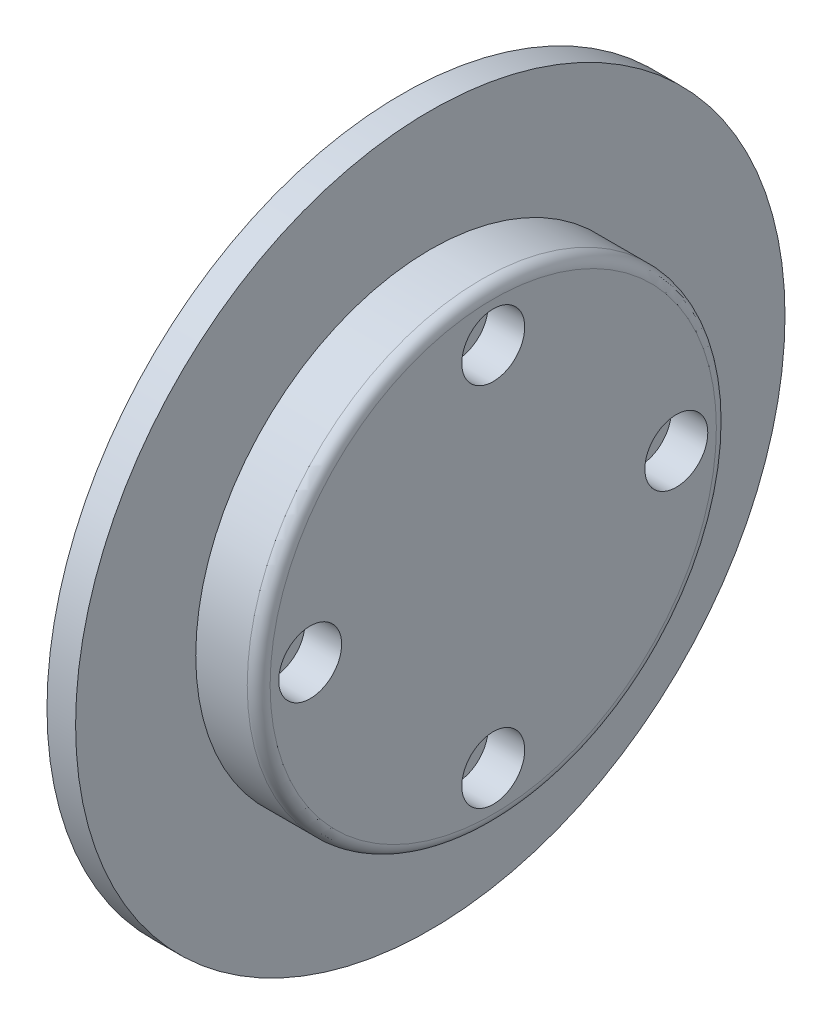
from build123d import *

# Parameters (mm, degrees)
SKETCH3_R                                           = 21
CUT_EXTRUDE1_DEPTH                                  = 12
FILLET1_R                                           = 1
FILLET2_R                                           = 2
CBORE_FOR_M6_HEX_SOCKET_HEAD_CAP_SCREW1_D           = 6.6
CBORE_FOR_M6_HEX_SOCKET_HEAD_CAP_SCREW1_CBORE_D     = 11
CBORE_FOR_M6_HEX_SOCKET_HEAD_CAP_SCREW1_CBORE_DEPTH = 6.4


with BuildPart() as part:
    # Sketch1 → Revolve1 (revolve)
    with BuildSketch(Plane.XY, mode=Mode.PRIVATE) as revolve1_sk:
        Polygon((0, 0), (0, 62), (5, 62), (5, 41), (16, 41), (16, 0), align=None)
    revolve(revolve1_sk.sketch.rotate(Axis((16, 0, 0), (-1, 0, 0)), 90), axis=Axis((16, 0, 0), (-1, 0, 0)))

    # Sketch3 → Cut-Extrude1 (cut)
    with BuildSketch(Plane.ZY):
        Circle(SKETCH3_R)
    extrude(amount=-CUT_EXTRUDE1_DEPTH, mode=Mode.SUBTRACT)

    # Fillet1
    fillet1_edges = [part.edges().sort_by_distance(p)[0] for p in [
        (12, 0, -21),
    ]]
    fillet(fillet1_edges, radius=FILLET1_R)

    # Fillet2
    fillet2_edges = [part.edges().sort_by_distance(p)[0] for p in [
        (16, 0, 41),
    ]]
    fillet(fillet2_edges, radius=FILLET2_R)

    # CBORE for M6 Hex Socket Head Cap Screw1 (through all)
    with Locations(Plane(origin=(16, 0, 0), x_dir=(0, 0, -1), z_dir=(1, 0, 0))):
        with Locations((0, -32), (32, 0), (0, 32), (-32, 0)):
            CounterBoreHole(CBORE_FOR_M6_HEX_SOCKET_HEAD_CAP_SCREW1_D / 2, CBORE_FOR_M6_HEX_SOCKET_HEAD_CAP_SCREW1_CBORE_D / 2, CBORE_FOR_M6_HEX_SOCKET_HEAD_CAP_SCREW1_CBORE_DEPTH)


solid = part.part
